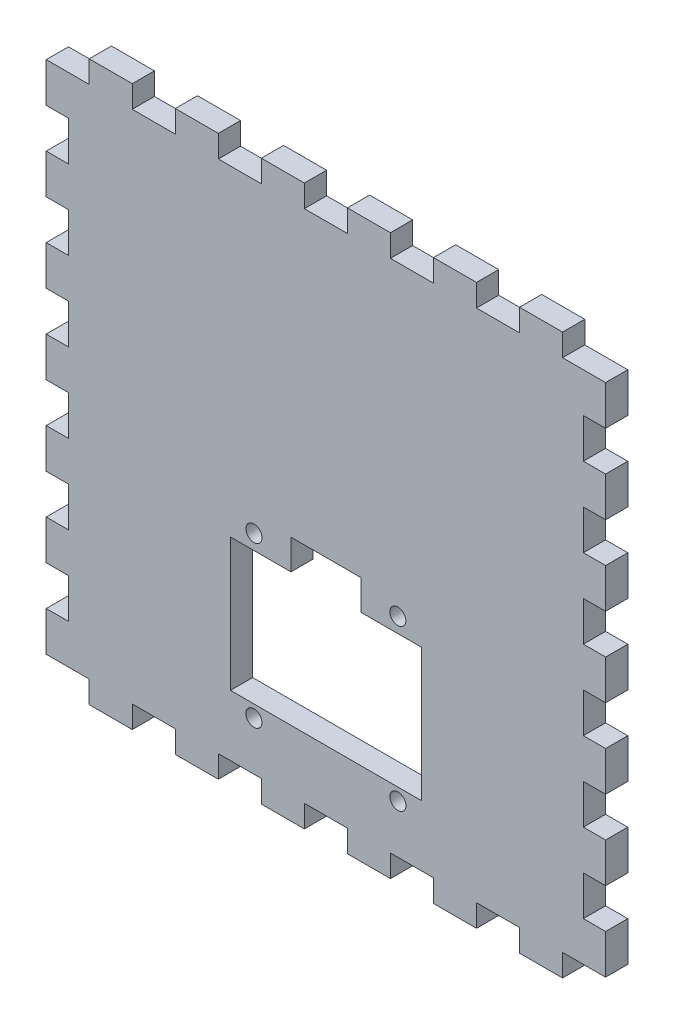
from build123d import *

# Parameters (mm, degrees)
SKETCH1_W           = 80
SKETCH1_H           = 80
BOSS_EXTRUDE1_DEPTH = 1.5875
SKETCH2_OUTSIDE_W   = 104.636
SKETCH2_OUTSIDE_H   = 104.636
CUT_EXTRUDE2_DEPTH  = 10
SKETCH3_R           = 1.15
CUT_EXTRUDE3_DEPTH  = 57.657573413


with BuildPart() as part:
    # Sketch1 → Boss-Extrude1 (new, symmetric)
    with BuildSketch(Plane.XY):
        Rectangle(SKETCH1_W, SKETCH1_H)
    extrude(amount=BOSS_EXTRUDE1_DEPTH, both=True)

    # Sketch2 outside → Cut-Extrude2 (cut)
    with BuildSketch(Plane.XY.offset(1.5875)):
        Rectangle(SKETCH2_OUTSIDE_W, SKETCH2_OUTSIDE_H)
        Polygon((33.846153846, -36.825), (40, -36.825), (40, -31.159615385), (36.82, -31.159615385), (36.82, -25.494230769), (40, -25.494230769), (40, -19.828846154), (36.82, -19.828846154), (36.82, -14.163461538), (40, -14.163461538), (40, -8.498076923), (36.82, -8.498076923), (36.82, -2.832692308), (40, -2.832692308), (40, 2.832692308), (36.82, 2.832692308), (36.82, 8.498076923), (40, 8.498076923), (40, 14.163461538), (36.82, 14.163461538), (36.82, 19.828846154), (40, 19.828846154), (40, 25.494230769), (36.82, 25.494230769), (36.82, 31.159615385), (40, 31.159615385), (40, 36.825), (33.846153846, 36.825), (33.846153846, 40), (27.692307692, 40), (27.692307692, 36.825), (21.538461538, 36.825), (21.538461538, 40), (15.384615385, 40), (15.384615385, 36.825), (9.230769231, 36.825), (9.230769231, 40), (3.076923077, 40), (3.076923077, 36.825), (-3.076923077, 36.825), (-3.076923077, 40), (-9.230769231, 40), (-9.230769231, 36.825), (-15.384615385, 36.825), (-15.384615385, 40), (-21.538461538, 40), (-21.538461538, 36.825), (-27.692307692, 36.825), (-27.692307692, 40), (-33.846153846, 40), (-33.846153846, 36.825), (-40, 36.825), (-40, 31.159615385), (-36.82, 31.159615385), (-36.82, 25.494230769), (-40, 25.494230769), (-40, 19.828846154), (-36.82, 19.828846154), (-36.82, 14.163461538), (-40, 14.163461538), (-40, 8.498076923), (-36.82, 8.498076923), (-36.82, 2.832692308), (-40, 2.832692308), (-40, -2.832692308), (-36.82, -2.832692308), (-36.82, -8.498076923), (-40, -8.498076923), (-40, -14.163461538), (-36.82, -14.163461538), (-36.82, -19.828846154), (-40, -19.828846154), (-40, -25.494230769), (-36.82, -25.494230769), (-36.82, -31.159615385), (-40, -31.159615385), (-40, -36.825), (-33.846153846, -36.825), (-33.846153846, -40), (-27.692307692, -40), (-27.692307692, -36.825), (-21.538461538, -36.825), (-21.538461538, -40), (-15.384615385, -40), (-15.384615385, -36.825), (-9.230769231, -36.825), (-9.230769231, -40), (-3.076923077, -40), (-3.076923077, -36.825), (3.076923077, -36.825), (3.076923077, -40), (9.230769231, -40), (9.230769231, -36.825), (15.384615385, -36.825), (15.384615385, -40), (21.538461538, -40), (21.538461538, -36.825), (27.692307692, -36.825), (27.692307692, -40), (33.846153846, -40), align=None, mode=Mode.SUBTRACT)
    extrude(amount=-CUT_EXTRUDE2_DEPTH, mode=Mode.SUBTRACT)

    # Sketch3 → Cut-Extrude3 (cut, through all)
    with BuildSketch(Plane.XY.offset(1.5875)):
        Polygon((-13.65, -9.125), (-13.65, -28.125), (13.65, -28.125), (13.65, -9.125), (5, -9.125), (5, -4.825), (-5, -4.825), (-5, -9.125), align=None)
        with Locations((-10.284555817, -6.975)):
            Circle(SKETCH3_R)
        with Locations((10.284555817, -6.975)):
            Circle(SKETCH3_R)
        with Locations((-10.3, -29.875)):
            Circle(SKETCH3_R)
        with Locations((10.3, -29.875)):
            Circle(SKETCH3_R)
    extrude(amount=-CUT_EXTRUDE3_DEPTH, mode=Mode.SUBTRACT)


solid = part.part
